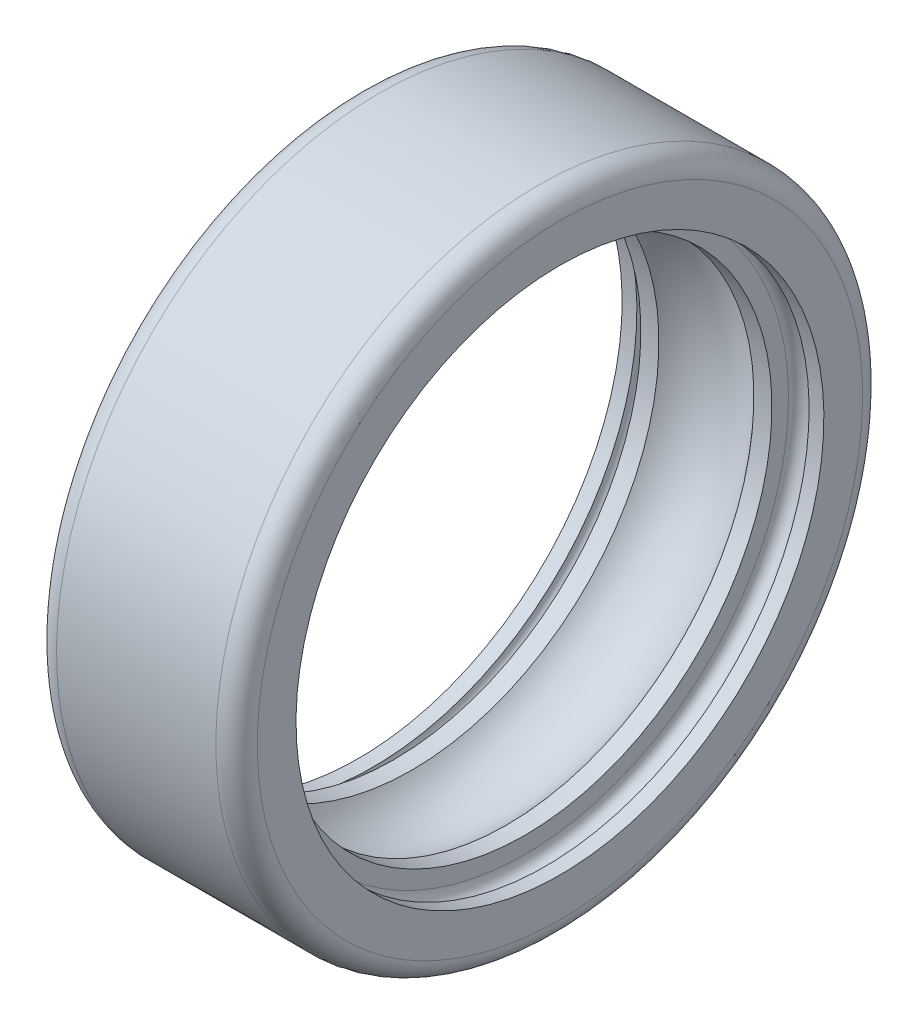
from build123d import *


with BuildPart() as part:
    # Esboço1 → Revolução1 (revolve)
    with BuildSketch(Plane.XY):
        with BuildLine():
            ThreePointArc((-2.5, 7.500000358), (-2.3438088, 7.865403093), (-1.97045185, 8.001489236))
            Line((-1.97045185, 8.001489236), (1.974326959, 8.001489236))
            ThreePointArc((1.974326959, 8.001489236), (2.345137016, 7.863925327), (2.5, 7.500000358))
            Line((2.5, 7.500000358), (2.5, 6.540774236))
            Line((2.5, 6.540774236), (2.133417427, 6.540774236))
            ThreePointArc((2.133417427, 6.540774236), (1.87849288, 6.795698783), (1.623568333, 6.540774236))
            Line((1.623568333, 6.540774236), (1.623568333, 6.129824257))
            Line((1.623568333, 6.129824257), (1.176947721, 6.129824257))
            ThreePointArc((1.176947721, 6.129824257), (0, 6.699881214), (-1.176947721, 6.129824257))
            Line((-1.176947721, 6.129824257), (-1.623568333, 6.129824257))
            Line((-1.623568333, 6.129824257), (-1.623568333, 6.540774236))
            ThreePointArc((-1.623568333, 6.540774236), (-1.87849288, 6.795698783), (-2.133417427, 6.540774236))
            Line((-2.133417427, 6.540774236), (-2.5, 6.540774236))
            Line((-2.5, 6.540774236), (-2.5, 7.500000358))
        make_face()
    revolve(axis=Axis((0, 0.001488878, 0), (-0.9999999196990055, -0.000400751771926105, 0)))


solid = part.part
